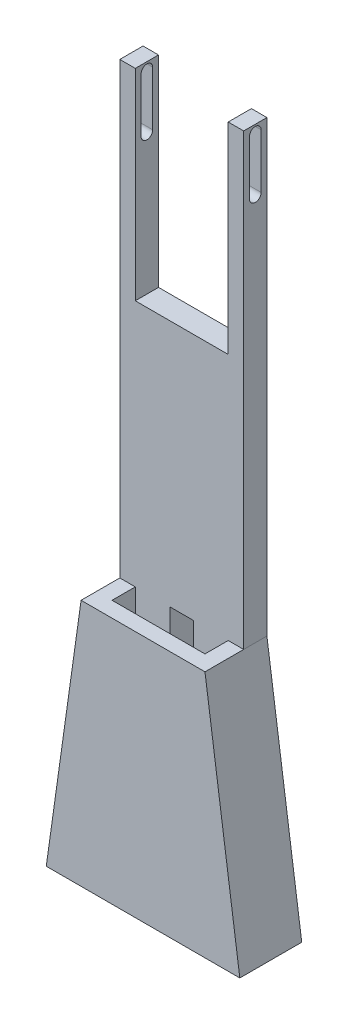
from build123d import *

# Parameters (mm, degrees)
EXTRUDE_1_DEPTH          = 30
SKETCH_5_W               = 160
SKETCH_5_H               = 320
EXTRUDE_4_DEPTH          = 50
SKETCH_6_W               = 120
SKETCH_6_H               = 300
CUT_EXTRUDE_1_DEPTH      = 30
SKETCH_7_W               = 30
SKETCH_7_H               = 280
CUT_EXTRUDE_2_DEPTH      = 766.965155529
CUT_EXTRUDE_4_DEPTH      = 555.376568193
CUT_EXTRUDE_4_DEPTH_BACK = 555.376568193
SKETCH_10_W              = 120
SKETCH_10_H              = 180
CUT_EXTRUDE_5_DEPTH      = 766.965155601
EXTRUDE_5_DEPTH          = 80


with BuildPart() as part:
    # 草图1 → 凸台-拉伸1 (new body)
    with BuildSketch(Plane.XY):
        with BuildLine():
            Line((-550.33557047, 530.40869088), (-550.33557047, -369.59130912))
            Line((-550.33557047, -369.59130912), (-390.33557047, -369.59130912))
            Line((-390.33557047, -369.59130912), (-390.33557047, 530.40869088))
            Line((-390.33557047, 530.40869088), (-410.33557047, 530.40869088))
            Line((-410.33557047, 530.40869088), (-410.33557047, 450.40869088))
            ThreePointArc((-410.33557047, 450.40869088), (-470.33557047, 390.40869088), (-530.33557047, 450.40869088))
            Line((-530.33557047, 450.40869088), (-530.33557047, 530.40869088))
            Line((-530.33557047, 530.40869088), (-550.33557047, 530.40869088))
        make_face()
    extrude(amount=EXTRUDE_1_DEPTH)

    # 草图5 → 凸台-拉伸4 (add)
    with BuildSketch(Plane.XY.offset(30)):
        with Locations((-470.33557047, -209.59130912)):
            Rectangle(SKETCH_5_W, SKETCH_5_H)
    extrude(amount=EXTRUDE_4_DEPTH)

    # 草图6 → 切除-拉伸1 (cut)
    with BuildSketch(Plane.XY.offset(30)):
        with Locations((-470.33557047, -199.59130912)):
            Rectangle(SKETCH_6_W, SKETCH_6_H)
    extrude(amount=CUT_EXTRUDE_1_DEPTH, mode=Mode.SUBTRACT)

    # 草图7 → 切除-拉伸2 (cut, through all)
    with BuildSketch(Plane.XY.offset(30)):
        with Locations((-470.33557047, -189.59130912)):
            Rectangle(SKETCH_7_W, SKETCH_7_H)
    extrude(amount=-CUT_EXTRUDE_2_DEPTH, mode=Mode.SUBTRACT)

    # 草图9 → 切除-拉伸4 (cut, two sides: drawn at the far end of the back side and taken through both)
    with BuildSketch(Plane(origin=(-530.33557047, 0, 0), x_dir=(0, 0, -1), z_dir=(1, 0, 0)).offset(-CUT_EXTRUDE_4_DEPTH_BACK)):
        with BuildLine():
            Line((-7.5, 450.40869088), (-7.5, 520.40869088))
            ThreePointArc((-7.5, 520.40869088), (-15, 527.90869088), (-22.5, 520.40869088))
            Line((-22.5, 520.40869088), (-22.5, 450.40869088))
            ThreePointArc((-22.5, 450.40869088), (-15, 442.90869088), (-7.5, 450.40869088))
        make_face()
    extrude(amount=CUT_EXTRUDE_4_DEPTH + CUT_EXTRUDE_4_DEPTH_BACK, mode=Mode.SUBTRACT)

    # 草图10 → 切除-拉伸5 (cut, through all)
    with BuildSketch(Plane.XY.offset(30)):
        with Locations((-470.33557047, 360.40869088)):
            Rectangle(SKETCH_10_W, SKETCH_10_H)
    extrude(amount=-CUT_EXTRUDE_5_DEPTH, mode=Mode.SUBTRACT)

    # 草图11 → 凸台-拉伸5 (add)
    with BuildSketch(Plane.XY.offset(80)):
        Polygon((-550.33557047, -369.59130912), (-595.33557047, -369.59130912), (-550.33557047, -49.59130912), align=None)
        Polygon((-390.33557047, -369.59130912), (-345.33557047, -369.59130912), (-390.33557047, -49.59130912), align=None)
    extrude(amount=-EXTRUDE_5_DEPTH)


solid = part.part
